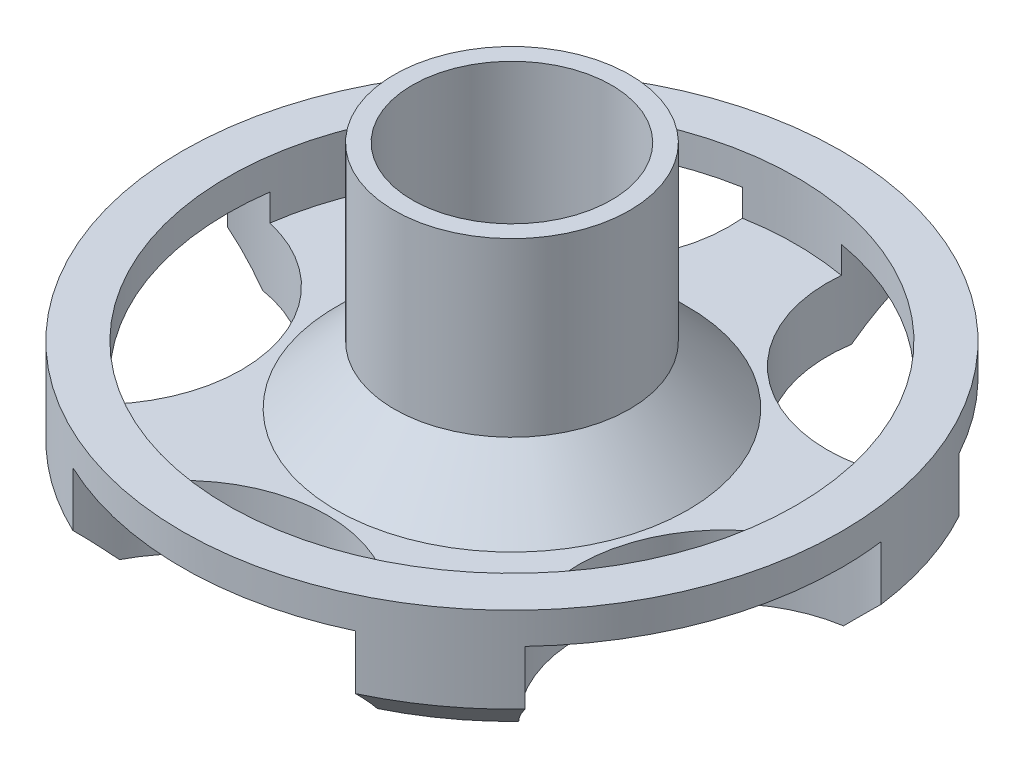
from build123d import *

# Parameters (mm, degrees)
CUT_EXTRUDE1_REACH = 69.967
SKETCH3_R          = 11
SKETCH4_R          = 16
CUT_EXTRUDE2_DEPTH = 10


with BuildPart() as part:
    # Sketch2 → Revolve1 (revolve)
    with BuildSketch(Plane.XY, mode=Mode.PRIVATE) as revolve1_sk:
        Polygon((10.935942394, 19), (-2.064057606, 19), (-2.064057606, 0), (-8.495542791, -6.431485186), (-20.464057606, -6.431485186), (-20.464057606, 0), (-25.464057606, 0), (-25.464057606, -9.462439506), (-21.464057606, -13.462439506), (10.935942394, -13.462439506), align=None)
    revolve(revolve1_sk.sketch.rotate(Axis((10.935942394, -13.462439506, 0), (0, 1, 0)), 180), axis=Axis((10.935942394, -13.462439506, 0), (0, 1, 0)))

    # Sketch3 → Cut-Extrude1 (cut, up to next)
    with BuildSketch(Plane(origin=(0, 19, 0), x_dir=(1, 0, 0), z_dir=(0, 1, 0)), mode=Mode.PRIVATE) as cut_extrude1_sk1:
        with Locations(Location((10.935942394, 0, 0), (0, 0, 180))):
            Circle(SKETCH3_R)
    cut_extrude1_tool1 = extrude(cut_extrude1_sk1.sketch, amount=-CUT_EXTRUDE1_REACH, mode=Mode.PRIVATE) & part.part
    add(cut_extrude1_tool1.solids().sort_by_distance((10.935942, 19, 0))[0], mode=Mode.SUBTRACT)

    # Sketch4 → Cut-Extrude2 (cut)
    with BuildSketch(Plane.XZ.offset(13.462439506)):
        with Locations((10.935942394, 36.4)):
            Circle(SKETCH4_R)
        with Locations((45.554399587, 11.248218595)):
            Circle(SKETCH4_R)
        with Locations((32.331325578, -29.448218595)):
            Circle(SKETCH4_R)
        with Locations((-10.459440789, -29.448218595)):
            Circle(SKETCH4_R)
        with Locations((-23.682514799, 11.248218595)):
            Circle(SKETCH4_R)
    extrude(amount=-CUT_EXTRUDE2_DEPTH, mode=Mode.SUBTRACT)


solid = part.part
